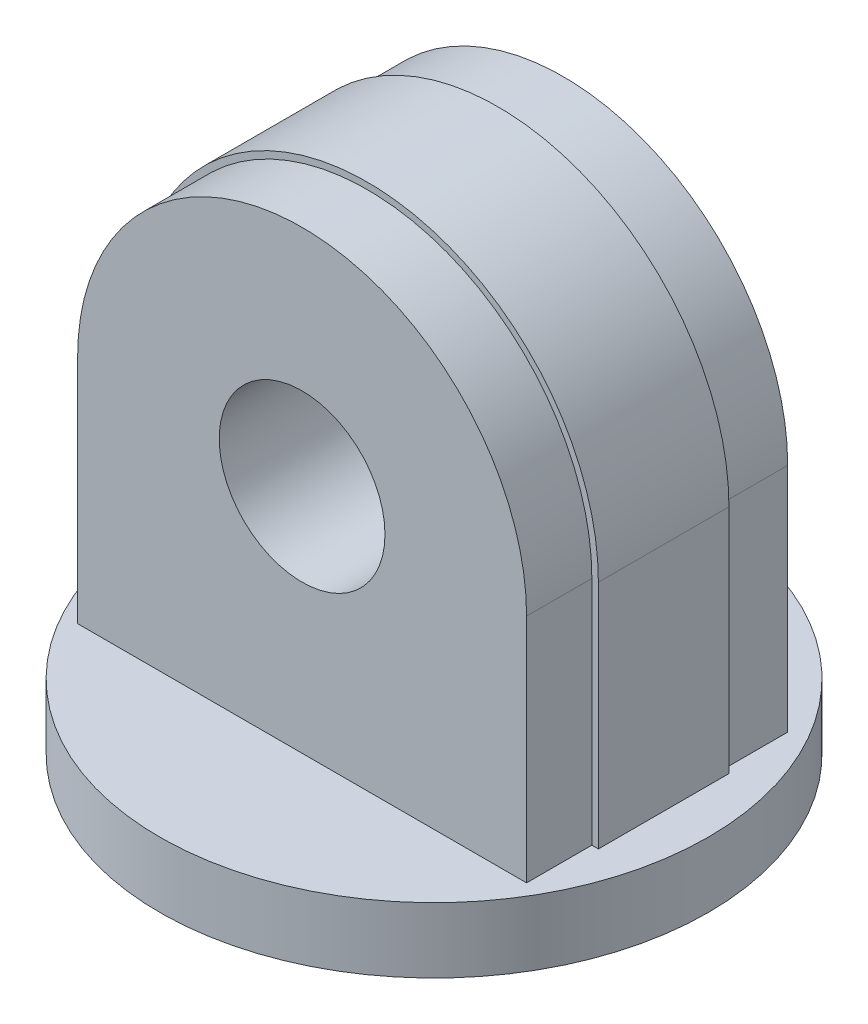
from build123d import *

# Parameters (mm, degrees)
EXTRUDE1_DEPTH     = 5.08
SKETCH4_R          = 10.674627582
EXTRUDE2_DEPTH     = 2.54
SKETCH6_R          = 3.225
CUT_EXTRUDE1_DEPTH = 29.049397538
EXTRUDE3_DEPTH     = 2.54


with BuildPart() as part:
    # Sketch3 → Extrude1 (new, symmetric)
    with BuildSketch(Plane.XY):
        with BuildLine():
            Line((17.977749936, -9.697339402), (0, -9.697339402))
            Line((0, -9.697339402), (0, -0.708464433))
            ThreePointArc((0, -0.708464433), (8.988874968, 8.280410535), (17.977749936, -0.708464433))
            Line((17.977749936, -0.708464433), (17.977749936, -9.697339402))
        make_face()
    extrude(amount=EXTRUDE1_DEPTH, both=True)

    # Sketch4 → Extrude2 (add)
    with BuildSketch(Plane.XZ.offset(9.697339402)):
        with Locations((9.043585733, 0)):
            Circle(SKETCH4_R)
    extrude(amount=EXTRUDE2_DEPTH)

    # Sketch6 → Cut-Extrude1 (cut, through all)
    with BuildSketch(Plane.XY.offset(5.08)):
        with Locations((8.988874968, -0.708464433)):
            Circle(SKETCH6_R)
    extrude(amount=-CUT_EXTRUDE1_DEPTH, mode=Mode.SUBTRACT)

    # Sketch8 → Extrude3 (cut)
    with BuildSketch(Plane.XY.offset(5.08)):
        with BuildLine():
            Line((0.254, -9.697339402), (0, -9.697339402))
            Line((0, -9.697339402), (0, -0.708464433))
            ThreePointArc((0, -0.708464433), (8.988874968, 8.280410535), (17.977749936, -0.708464433))
            Line((17.977749936, -0.708464433), (17.977749936, -9.697339402))
            Line((17.977749936, -9.697339402), (17.723749936, -9.697339402))
            Line((17.723749936, -9.697339402), (17.723749936, -0.708464433))
            ThreePointArc((17.723749936, -0.708464433), (8.988874968, 8.026410535), (0.254, -0.708464433))
            Line((0.254, -0.708464433), (0.254, -9.697339402))
        make_face()
    extrude3 = extrude(amount=-EXTRUDE3_DEPTH, mode=Mode.SUBTRACT)

    # Mirror1: Extrude3 across plane
    add(extrude3.mirror(Plane.XY), mode=Mode.SUBTRACT)


solid = part.part
